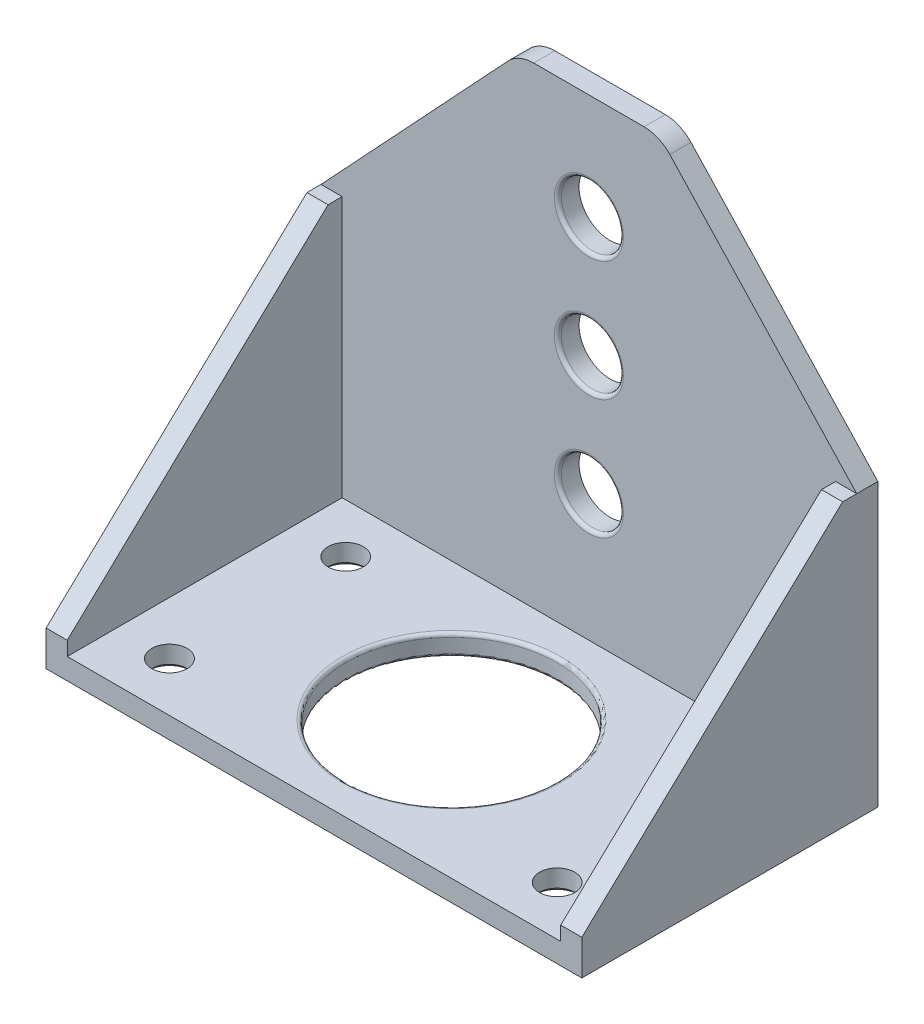
from build123d import *

# Parameters (mm, degrees)
EXTRUDE_1_DEPTH              = 3
SKETCH_2_W                   = 76
SKETCH_2_H                   = 3
EXTRUDE_2_DEPTH              = 39
CUT_EXTRUDE_1_DEPTH          = 52
CUT_EXTRUDE_2_DEPTH          = 52
EXTRUDE_3_DEPTH              = 3
HOLE_WIZARD_M6_2_D           = 5
HOLE_WIZARD_M6_2_CSINK_D     = 6.05
HOLE_WIZARD_M6_2_CSINK_ANGLE = 90
FILLET_4_R                   = 5
FILLET_5_R                   = 0.5


with BuildPart() as part:
    # 草图1 → 凸台-拉伸1 (new body)
    with BuildSketch(Plane.XY):
        Polygon((48, 70), (28, 70), (0, 40), (0, 0), (76, 0), (76, 40), align=None)
    extrude(amount=EXTRUDE_1_DEPTH)

    # 草图2 → 凸台-拉伸2 (add)
    with BuildSketch(Plane.XY.offset(3)):
        with Locations((38, 1.5)):
            Rectangle(SKETCH_2_W, SKETCH_2_H)
    extrude(amount=EXTRUDE_2_DEPTH)

    # 草图7 → 切除-拉伸1 (cut)
    with BuildSketch(Plane.XY.offset(3)):
        with BuildLine():
            ThreePointArc((42.4, 55), (41.111269837, 58.111269837), (38, 59.4))
            Line((38, 59.4), (38, 50.6))
            ThreePointArc((38, 50.6), (41.111269837, 51.888730163), (42.4, 55))
        make_face()
        with BuildLine():
            Line((38, 50.6), (38, 59.4))
            ThreePointArc((38, 59.4), (33.6, 55), (38, 50.6))
        make_face()
        with BuildLine():
            ThreePointArc((42.4, 38), (41.111269837, 41.111269837), (38, 42.4))
            Line((38, 42.4), (38, 33.6))
            ThreePointArc((38, 33.6), (41.111269837, 34.888730163), (42.4, 38))
        make_face()
        with BuildLine():
            Line((38, 33.6), (38, 42.4))
            ThreePointArc((38, 42.4), (33.6, 38), (38, 33.6))
        make_face()
        with BuildLine():
            ThreePointArc((42.4, 21), (41.111269837, 24.111269837), (38, 25.4))
            Line((38, 25.4), (38, 16.6))
            ThreePointArc((38, 16.6), (41.111269837, 17.888730163), (42.4, 21))
        make_face()
        with BuildLine():
            Line((38, 16.6), (38, 25.4))
            ThreePointArc((38, 25.4), (33.6, 21), (38, 16.6))
        make_face()
    extrude(amount=-CUT_EXTRUDE_1_DEPTH, mode=Mode.SUBTRACT)

    # 草图8 → 切除-拉伸2 (cut)
    with BuildSketch(Plane(origin=(0, 3, 0), x_dir=(1, 0, 0), z_dir=(0, 1, 0))):
        with BuildLine():
            ThreePointArc((23, -22.5), (38, -37.5), (53, -22.5))
            Line((53, -22.5), (23, -22.5))
        make_face()
        with BuildLine():
            Line((23, -22.5), (53, -22.5))
            ThreePointArc((53, -22.5), (38, -7.5), (23, -22.5))
        make_face()
    extrude(amount=-CUT_EXTRUDE_2_DEPTH, mode=Mode.SUBTRACT)

    # 草图10 → 凸台-拉伸3 (add)
    with BuildSketch(Plane.ZY):
        Polygon((3, 40), (5, 40), (42, 5), (42, 3), (3, 3), align=None)
    extrude_3 = extrude(amount=-EXTRUDE_3_DEPTH)

    # 镜向1: 凸台-拉伸3 across plane
    add(extrude_3.mirror(Plane(origin=(38, 0, 0), x_dir=(0, 0, 1), z_dir=(1, 0, 0))))

    # M6 螺纹孔2 (through all)
    with Locations(Plane(origin=(0, 0, 0), x_dir=(-1, 0, 0), z_dir=(0, -1, 0))):
        with Locations((-65.5, -10), (-10.5, -10), (-10.5, -35), (-65.5, -35)):
            CounterSinkHole(HOLE_WIZARD_M6_2_D / 2, HOLE_WIZARD_M6_2_CSINK_D / 2, counter_sink_angle=HOLE_WIZARD_M6_2_CSINK_ANGLE)

    # 圆角4
    fillet_4_edges = [part.edges().sort_by_distance(p)[0] for p in [
        (48, 70, 1.5),
        (28, 70, 1.5),
    ]]
    fillet(fillet_4_edges, radius=FILLET_4_R)

    # 圆角5
    fillet_5_edges = [part.edges().sort_by_distance(p)[0] for p in [
        (38, 50.6, 3),
        (38, 33.6, 3),
        (38, 16.6, 3),
        (23, 0, 22.5),
        (23, 3, 22.5),
    ]]
    fillet(fillet_5_edges, radius=FILLET_5_R)


solid = part.part
